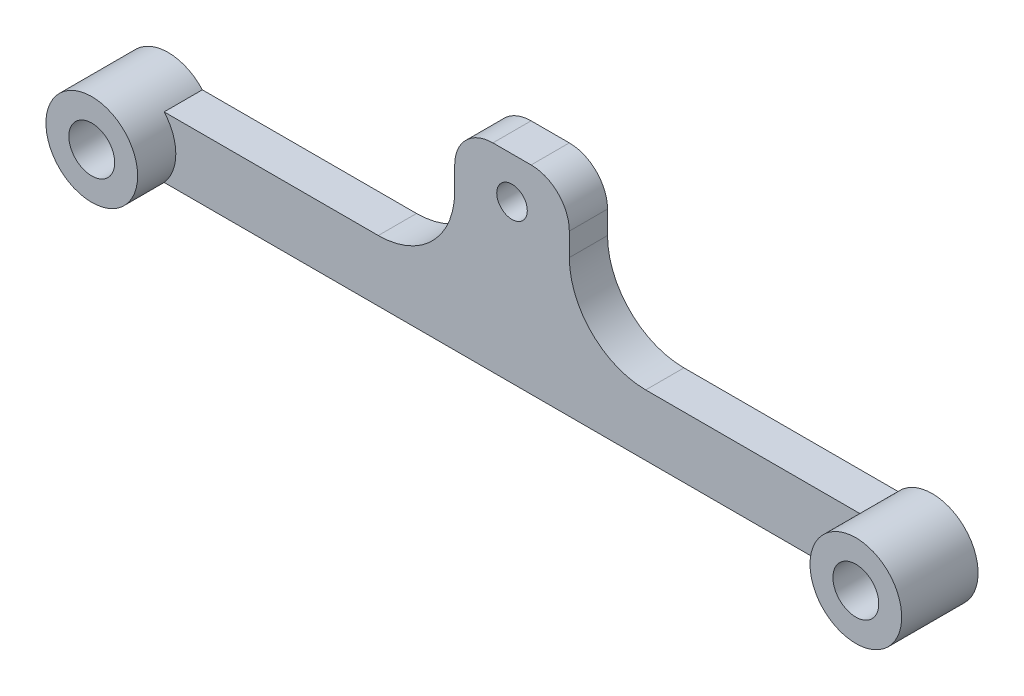
from build123d import *

# Parameters (mm, degrees)
SKETCH_1_R          = 6
EXTRUDE_1_DEPTH     = 10
SKETCH_3_W          = 5
SKETCH_3_H          = 8
EXTRUDE_2_DEPTH     = 50
SKETCH_2_R          = 3
CUT_EXTRUDE_1_DEPTH = 30
SKETCH_14_W         = 15
SKETCH_14_H         = 18
EXTRUDE_7_DEPTH     = 5
FILLET_2_R          = 5
FILLET_3_R          = 10
SKETCH_15_R         = 2
CUT_EXTRUDE_4_DEPTH = 5


with BuildPart() as part:
    # 草图1 → 凸台-拉伸1 (new body)
    with BuildSketch(Plane.XY):
        Circle(SKETCH_1_R)
    extrude(amount=EXTRUDE_1_DEPTH)

    # 草图3 → 凸台-拉伸2 (add)
    with BuildSketch(Plane(origin=(0, 0, 0), x_dir=(0, 0, -1), z_dir=(1, 0, 0))):
        with Locations((-2.5, 0)):
            Rectangle(SKETCH_3_W, SKETCH_3_H)
    extrude(amount=EXTRUDE_2_DEPTH)

    # 草图2 → 切除-拉伸1 (cut)
    with BuildSketch(Plane.XY.offset(10)):
        Circle(SKETCH_2_R)
    extrude(amount=-CUT_EXTRUDE_1_DEPTH, mode=Mode.SUBTRACT)

    # 镜向1: part across plane


with BuildPart() as part_1:
    add(part.part)
    add(part.part.mirror(Plane.ZY.offset(-50)))

    # 草图14 → 凸台-拉伸7 (add)
    with BuildSketch(Plane(origin=(0, 0, 0), x_dir=(-1, 0, 0), z_dir=(0, 0, -1))):
        with Locations((-50, 13)):
            Rectangle(SKETCH_14_W, SKETCH_14_H)
    extrude(amount=-EXTRUDE_7_DEPTH)

    # 圆角2
    fillet_2_edges = [part_1.edges().sort_by_distance(p)[0] for p in [
        (57.5, 22, 2.5),
        (42.5, 22, 2.5),
    ]]
    fillet(fillet_2_edges, radius=FILLET_2_R)

    # 圆角3
    fillet_3_edges = [part_1.edges().sort_by_distance(p)[0] for p in [
        (42.5, 4, 2.5),
        (57.5, 4, 2.5),
    ]]
    fillet(fillet_3_edges, radius=FILLET_3_R)

    # 草图15 → 切除-拉伸4 (cut)
    with BuildSketch(Plane(origin=(0, 0, 0), x_dir=(-1, 0, 0), z_dir=(0, 0, -1))):
        with Locations((-50, 16.57)):
            Circle(SKETCH_15_R)
    extrude(amount=-CUT_EXTRUDE_4_DEPTH, mode=Mode.SUBTRACT)


solid = part_1.part
